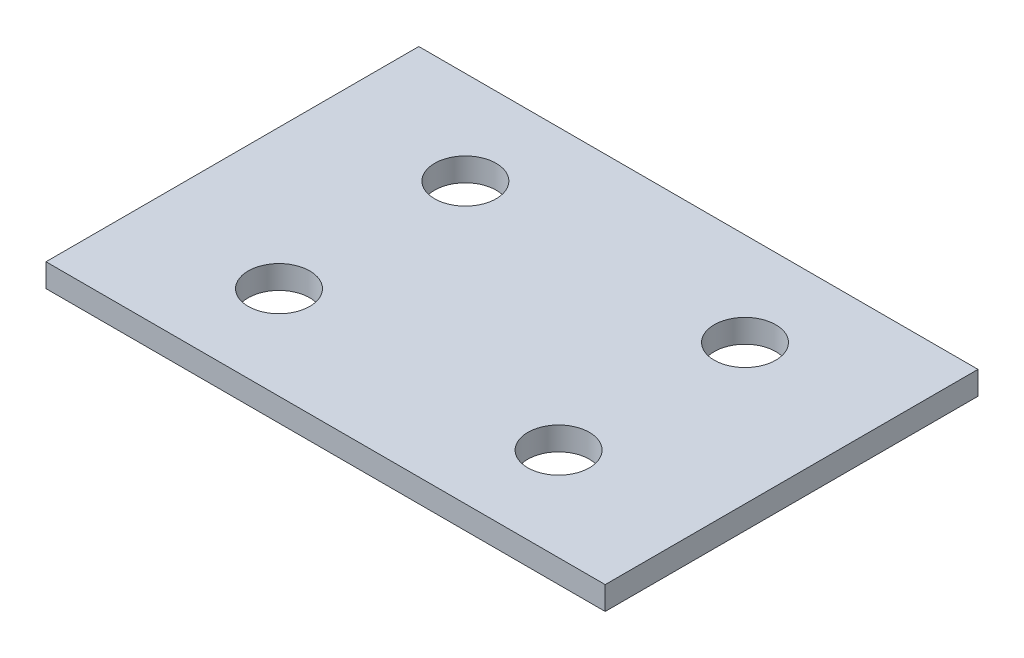
from build123d import *

# Parameters (mm, degrees)
SKETCH1_W           = 76.2
SKETCH1_H           = 50.8
BOSS_EXTRUDE1_DEPTH = 3.175
SKETCH3_R           = 4.191
CUT_EXTRUDE1_DEPTH  = 92.636022529


with BuildPart() as part:
    # Sketch1 → Boss-Extrude1 (new body)
    with BuildSketch(Plane(origin=(0, 0, 0), x_dir=(1, 0, 0), z_dir=(0, 1, 0))):
        with Locations((38.1, 25.4)):
            Rectangle(SKETCH1_W, SKETCH1_H)
    extrude(amount=BOSS_EXTRUDE1_DEPTH)

    # Sketch3 → Cut-Extrude1 (cut, through all)
    with BuildSketch(Plane(origin=(0, 3.175, 0), x_dir=(1, 0, 0), z_dir=(0, 1, 0))):
        with Locations(Location((19.05, 38.1, 0), (0, 0, 270))):
            Circle(SKETCH3_R)
        with Locations(Location((19.05, 12.7, 0), (0, 0, 270))):
            Circle(SKETCH3_R)
        with Locations(Location((57.15, 38.1, 0), (0, 0, 270))):
            Circle(SKETCH3_R)
        with Locations(Location((57.15, 12.7, 0), (0, 0, 270))):
            Circle(SKETCH3_R)
    extrude(amount=-CUT_EXTRUDE1_DEPTH, mode=Mode.SUBTRACT)


solid = part.part
